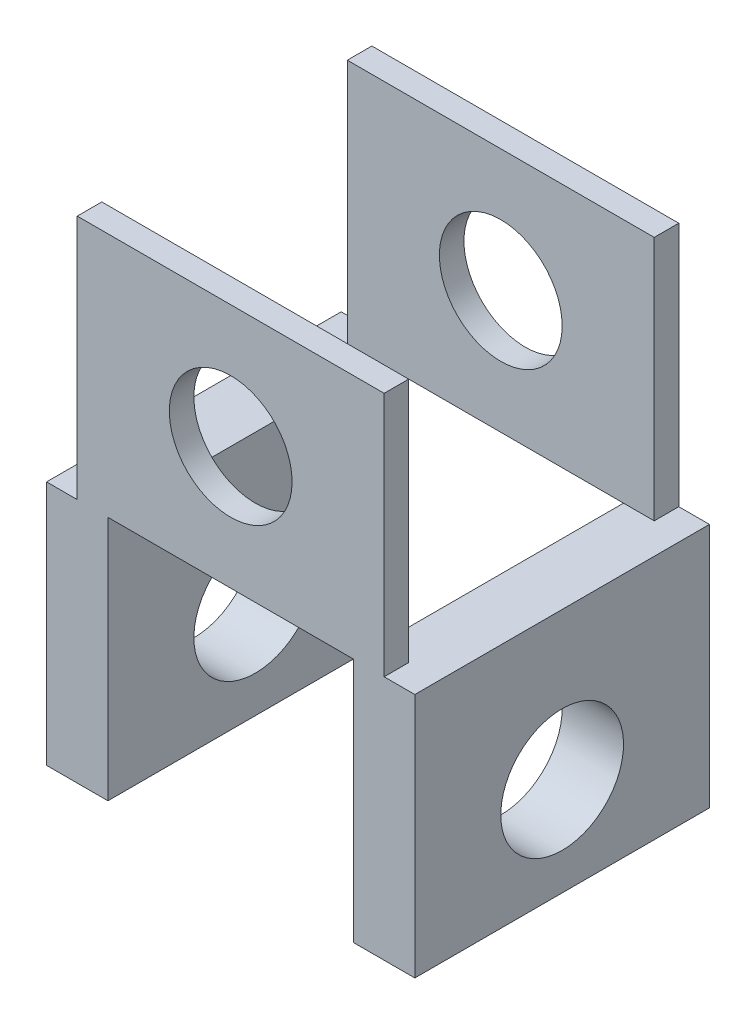
from build123d import *

# Parameters (mm, degrees)
SKETCH1_R           = 5
BOSS_EXTRUDE1_DEPTH = 2
BOSS_EXTRUDE2_DEPTH = 12
SKETCH2_R           = 5
CUT_EXTRUDE1_DEPTH  = 48


with BuildPart() as part:
    # Sketch1 → Boss-Extrude1 (new body)
    with BuildSketch(Plane.XY):
        Polygon((-10, -10), (10, -10), (12.5, -10), (12.5, 10), (-12.5, 10), (-12.5, -10), align=None)
        Circle(SKETCH1_R, mode=Mode.SUBTRACT)
    boss_extrude1 = extrude(amount=BOSS_EXTRUDE1_DEPTH)

    # Sketch1<3> → Boss-Extrude2 (add)
    with BuildSketch(Plane.XY):
        Polygon((10, -10), (10, -30), (15, -30), (15, -10), (12.5, -10), align=None)
        Polygon((-10, -30), (-10, -10), (-12.5, -10), (-15, -10), (-15, -30), align=None)
    boss_extrude2 = extrude(amount=BOSS_EXTRUDE2_DEPTH)

    # Mirror1: Boss-Extrude2 across plane
    add(boss_extrude2.mirror(Plane.XY.offset(12)))

    # Mirror2: Boss-Extrude1 across plane
    add(boss_extrude1.mirror(Plane.XY.offset(12)))

    # Sketch2 → Cut-Extrude1 (cut)
    with BuildSketch(Plane.ZY.offset(15)):
        with Locations(Location((12, -22, 0), (0, 0, 270))):
            Circle(SKETCH2_R)
    extrude(amount=-CUT_EXTRUDE1_DEPTH, mode=Mode.SUBTRACT)


solid = part.part
